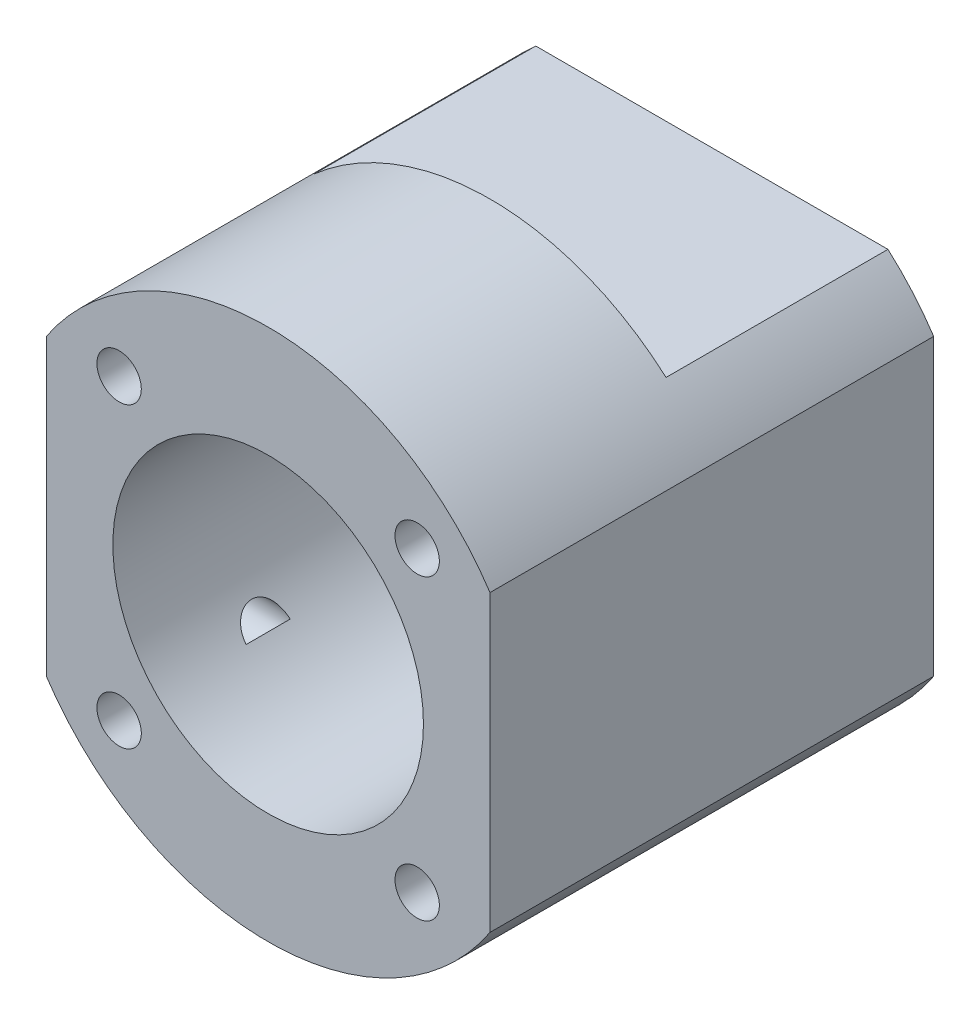
from build123d import *

# Parameters (mm, degrees)
SCHIZZO1_R                   = 14
ESTRUSIONE_ESTRUSIONE1_DEPTH = 40
SCHIZZO4_R                   = 2
TAGLIO_ESTRUSIONE1_DEPTH     = 10
SCHIZZO5_R                   = 2
TAGLIO_ESTRUSIONE2_DEPTH     = 10
SCHIZZO6_W                   = 32.003306677
SCHIZZO6_H                   = 7.880991961
TAGLIO_ESTRUSIONE3_DEPTH     = 20


with BuildPart() as part:
    # Schizzo1 → Estrusione-Estrusione1 (new body)
    with BuildSketch(Plane.XY):
        with BuildLine():
            Line((20, -13.266499161), (20, 13.266499161))
            ThreePointArc((20, 13.266499161), (0, 24), (-20, 13.266499161))
            Line((-20, 13.266499161), (-20, -13.266499161))
            ThreePointArc((-20, -13.266499161), (0, -24), (20, -13.266499161))
        make_face()
        Circle(SCHIZZO1_R, mode=Mode.SUBTRACT)
    extrude(amount=-ESTRUSIONE_ESTRUSIONE1_DEPTH)

    # Schizzo4 → Taglio-Estrusione1 (cut)
    with BuildSketch(Plane.ZY.offset(20)):
        with Locations((-10, 10)):
            Circle(SCHIZZO4_R)
        with Locations(Location((-10, -10, 0), (0, 0, 5.797939254))):
            Circle(SCHIZZO4_R)
        with Locations((-30, -10)):
            Circle(SCHIZZO4_R)
        with Locations(Location((-30, 10, 0), (0, 0, 354.202060746))):
            Circle(SCHIZZO4_R)
    extrude(amount=-TAGLIO_ESTRUSIONE1_DEPTH, mode=Mode.SUBTRACT)

    # Schizzo5 → Taglio-Estrusione2 (cut)
    with BuildSketch(Plane.XY):
        with Locations((-13.435028843, 13.435028843)):
            Circle(SCHIZZO5_R)
        with Locations(Location((13.435028843, 13.435028843, 0), (0, 0, 180))):
            Circle(SCHIZZO5_R)
        with Locations((13.435028843, -13.435028843)):
            Circle(SCHIZZO5_R)
        with Locations(Location((-13.435028843, -13.435028843, 0), (0, 0, 45.84964591))):
            Circle(SCHIZZO5_R)
    extrude(amount=-TAGLIO_ESTRUSIONE2_DEPTH, mode=Mode.SUBTRACT)

    # Schizzo6 → Taglio-Estrusione3 (cut)
    with BuildSketch(Plane(origin=(0, 0, -40), x_dir=(-1, 0, 0), z_dir=(0, 0, -1))):
        with Locations((0.127145472, 21.940495981)):
            Rectangle(SCHIZZO6_W, SCHIZZO6_H)
        with Locations((0.127145472, -21.940495981)):
            Rectangle(SCHIZZO6_W, SCHIZZO6_H)
    extrude(amount=-TAGLIO_ESTRUSIONE3_DEPTH, mode=Mode.SUBTRACT)


solid = part.part
